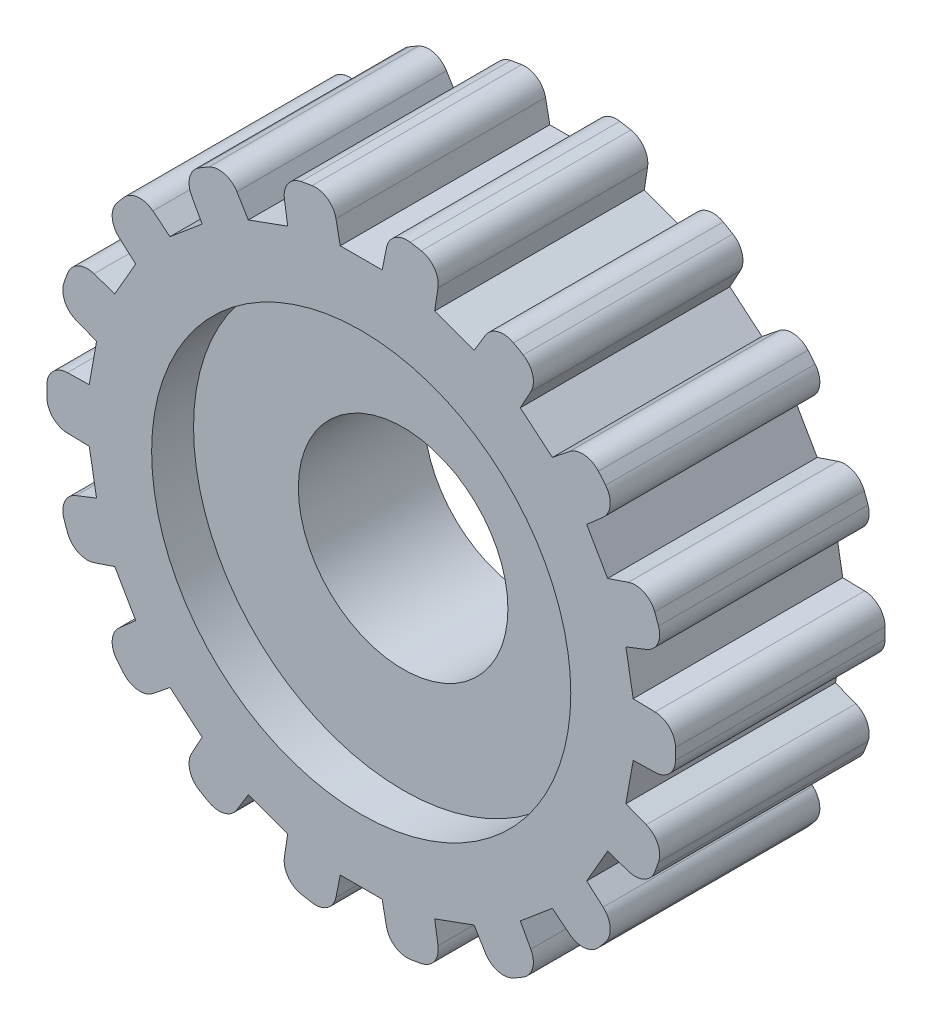
from build123d import *

# Parameters (mm, degrees)
SKETCH2_R                = 150
SKETCH2_R_2              = 50
BOSS_EXTRUDE1_DEPTH      = 50
CUT_EXTRUDE1_DEPTH       = 235.520787991
FILLET1_R                = 10
CIRPATTERN1_COUNT        = 18
FILLET1_OF_CIRPATTERN1_R = 10
SKETCH6_R                = 100
CUT_EXTRUDE2_DEPTH       = 20


with BuildPart() as part:
    # Sketch2 → Boss-Extrude1 (new, symmetric)
    with BuildSketch(Plane.XY):
        Circle(SKETCH2_R)
        Circle(SKETCH2_R_2, mode=Mode.SUBTRACT)
    extrude(amount=BOSS_EXTRUDE1_DEPTH, both=True)

    # Sketch5 → Cut-Extrude1 (cut, through all)
    with BuildSketch(Plane.XY.offset(50)):
        Polygon((-20, 180), (20, 180), (10, 130), (-10, 130), align=None)
    cut_extrude1 = extrude(amount=-CUT_EXTRUDE1_DEPTH, mode=Mode.SUBTRACT)

    # Fillet1
    fillet1_edges = [part.edges().sort_by_distance(p)[0] for p in [
        (13.871446547, 149.357232736, 0),
        (-13.871446547, 149.357232736, 0),
    ]]
    fillet(fillet1_edges, radius=FILLET1_R)

    # CirPattern1: Cut-Extrude1 ×18 about axis
    cirpattern1_axis = Axis((0, 0, 0), (0, 0, 1))
    for i in range(1, CIRPATTERN1_COUNT):
        add(cut_extrude1.rotate(cirpattern1_axis, i * 360 / CIRPATTERN1_COUNT), mode=Mode.SUBTRACT)

    # Fillet1 of CirPattern1
    fillet1_of_cirpattern1_edges = [part.edges().sort_by_distance(p)[0] for p in [
        (-38.048286187, 145.0942036, 0),
        (-64.118078107, 135.605575327, 0),
        (-85.378834074, 123.330672146, 0),
        (-106.631123166, 105.497884208, 0),
        (-122.411434515, 86.691641465, 0),
        (-136.282881062, 62.665591271, 0),
        (-144.679409353, 39.596319391, 0),
        (-149.496912182, 12.274903181, 0),
        (-149.496912182, -12.274903181, 0),
        (-144.679409353, -39.596319391, 0),
        (-136.282881062, -62.665591271, 0),
        (-122.411434515, -86.691641465, 0),
        (-106.631123166, -105.497884208, 0),
        (-85.378834074, -123.330672146, 0),
        (-64.118078107, -135.605575327, 0),
        (-38.048286187, -145.0942036, 0),
        (-13.871446547, -149.357232736, 0),
        (13.871446547, -149.357232736, 0),
        (38.048286187, -145.0942036, 0),
        (64.118078107, -135.605575327, 0),
        (85.378834074, -123.330672146, 0),
        (106.631123166, -105.497884208, 0),
        (122.411434515, -86.691641465, 0),
        (136.282881062, -62.665591271, 0),
        (144.679409353, -39.596319391, 0),
        (149.496912182, -12.274903181, 0),
        (149.496912182, 12.274903181, 0),
        (144.679409353, 39.596319391, 0),
        (136.282881062, 62.665591271, 0),
        (122.411434515, 86.691641465, 0),
        (106.631123166, 105.497884208, 0),
        (85.378834074, 123.330672146, 0),
        (64.118078107, 135.605575327, 0),
        (38.048286187, 145.0942036, 0),
    ]]
    fillet(fillet1_of_cirpattern1_edges, radius=FILLET1_OF_CIRPATTERN1_R)

    # Sketch6 → Cut-Extrude2 (cut)
    with BuildSketch(Plane.XY.offset(50)):
        Circle(SKETCH6_R)
    cut_extrude2 = extrude(amount=-CUT_EXTRUDE2_DEPTH, mode=Mode.SUBTRACT)

    # Mirror1: Cut-Extrude2 across plane
    add(cut_extrude2.mirror(Plane.XY), mode=Mode.SUBTRACT)


solid = part.part
